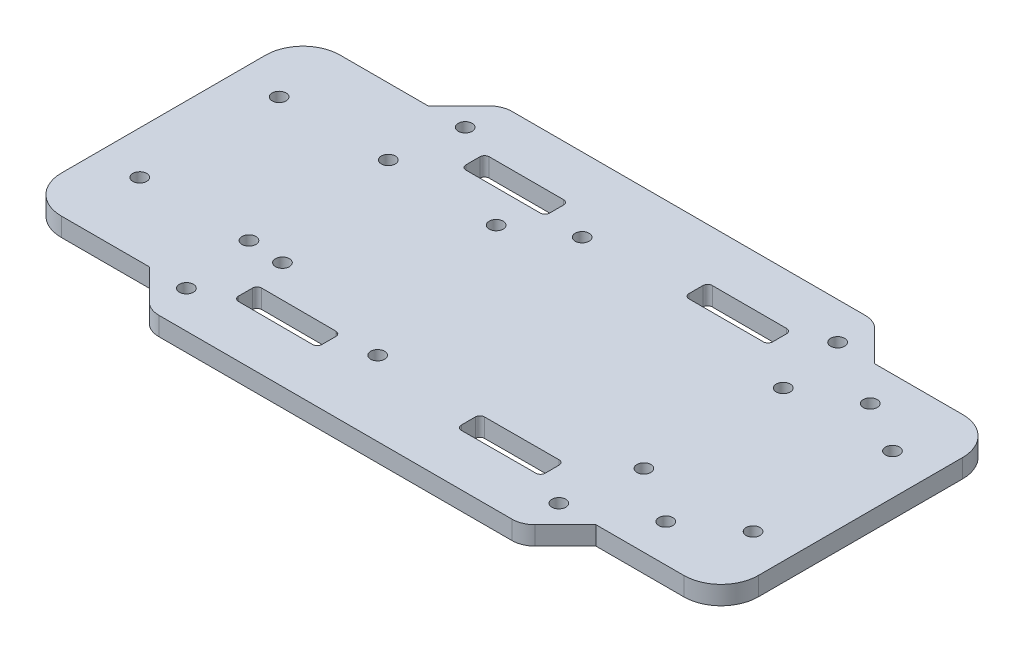
from build123d import *

# Parameters (mm, degrees)
SKETCH1_R           = 1.5
BOSS_EXTRUDE1_DEPTH = 4
SKETCH2_R           = 1.5
CUT_EXTRUDE1_DEPTH  = 4
SKETCH8_R           = 1.5
CUT_EXTRUDE5_DEPTH  = 85.436165497
SKETCH9_R           = 1.5
CUT_EXTRUDE6_DEPTH  = 10
CUT_EXTRUDE7_DEPTH  = 10


with BuildPart() as part:
    # Sketch1 → Boss-Extrude1 (new body)
    with BuildSketch(Plane(origin=(0, 0, 0), x_dir=(1, 0, 0), z_dir=(0, 1, 0))):
        with BuildLine():
            Line((-48.31716421, 29.901561441), (-41.781630304, 36.437095347))
            ThreePointArc((-41.781630304, 36.437095347), (-40.15951356, 37.520959103), (-38.246096398, 37.901561441))
            Line((-38.246096398, 37.901561441), (37.753903602, 37.901561441))
            ThreePointArc((37.753903602, 37.901561441), (39.667320764, 37.520959103), (41.289437508, 36.437095347))
            Line((41.289437508, 36.437095347), (47.824971414, 29.901561441))
            Line((47.824971414, 29.901561441), (66.753903602, 29.901561441))
            ThreePointArc((66.753903602, 29.901561441), (72.410757852, 27.55841569), (74.753903602, 21.901561441))
            Line((74.753903602, 21.901561441), (74.753903602, -22.098438559))
            ThreePointArc((74.753903602, -22.098438559), (72.410757852, -27.755292809), (66.753903602, -30.098438559))
            Line((66.753903602, -30.098438559), (47.824971414, -30.098438559))
            Line((47.824971414, -30.098438559), (41.289437508, -36.633972465))
            ThreePointArc((41.289437508, -36.633972465), (39.667320764, -37.717836222), (37.753903602, -38.098438559))
            Line((37.753903602, -38.098438559), (-38.246096398, -38.098438559))
            ThreePointArc((-38.246096398, -38.098438559), (-40.15951356, -37.717836222), (-41.781630304, -36.633972465))
            Line((-41.781630304, -36.633972465), (-48.31716421, -30.098438559))
            Line((-48.31716421, -30.098438559), (-67.246096398, -30.098438559))
            ThreePointArc((-67.246096398, -30.098438559), (-72.902950647, -27.755292809), (-75.246096398, -22.098438559))
            Line((-75.246096398, -22.098438559), (-75.246096398, 21.901561441))
            ThreePointArc((-75.246096398, 21.901561441), (-72.902950647, 27.55841569), (-67.246096398, 29.901561441))
            Line((-67.246096398, 29.901561441), (-48.31716421, 29.901561441))
        make_face()
        with Locations(Location((-7.246096398, 22, 0), (0, 0, 270))):
            Circle(SKETCH1_R, mode=Mode.SUBTRACT)
        with Locations(Location((54.753903602, 22, 0), (0, 0, 90))):
            Circle(SKETCH1_R, mode=Mode.SUBTRACT)
        with Locations(Location((54.753903602, -22, 0), (0, 0, 270))):
            Circle(SKETCH1_R, mode=Mode.SUBTRACT)
        with Locations(Location((-7.246096398, -22, 0), (0, 0, 90))):
            Circle(SKETCH1_R, mode=Mode.SUBTRACT)
    extrude(amount=-BOSS_EXTRUDE1_DEPTH)

    # Sketch2 → Cut-Extrude1 (cut)
    with BuildSketch(Plane(origin=(0, 0, 0), x_dir=(1, 0, 0), z_dir=(0, 1, 0))):
        with Locations(Location((-42.5, 15.539099556, 0), (0, 0, 270))):
            Circle(SKETCH2_R)
        with Locations(Location((-66, 15.539099556, 0), (0, 0, 270))):
            Circle(SKETCH2_R)
        with Locations(Location((-66, -14.460900444, 0), (0, 0, 270))):
            Circle(SKETCH2_R)
        with Locations(Location((-42.5, -14.460900444, 0), (0, 0, 270))):
            Circle(SKETCH2_R)
        with Locations(Location((66, 15.539099556, 0), (0, 0, 90))):
            Circle(SKETCH2_R)
        with Locations(Location((66, -14.460900444, 0), (0, 0, 90))):
            Circle(SKETCH2_R)
        with Locations(Location((42.5, -14.460900444, 0), (0, 0, 90))):
            Circle(SKETCH2_R)
        with Locations(Location((42.5, 15.539099556, 0), (0, 0, 90))):
            Circle(SKETCH2_R)
    extrude(amount=-CUT_EXTRUDE1_DEPTH, mode=Mode.SUBTRACT)

    # Sketch8 → Cut-Extrude5 (cut, through all)
    with BuildSketch(Plane.XZ.offset(4)):
        with Locations(Location((-40.31716421, -29.901561441, 0), (0, 0, 270))):
            Circle(SKETCH8_R)
        with Locations(Location((39.824971414, -29.901561441, 0), (0, 0, 90))):
            Circle(SKETCH8_R)
        with Locations(Location((39.824971414, 30.098438559, 0), (0, 0, 270))):
            Circle(SKETCH8_R)
        with Locations(Location((-40.31716421, 30.098438559, 0), (0, 0, 90))):
            Circle(SKETCH8_R)
    extrude(amount=-CUT_EXTRUDE5_DEPTH, mode=Mode.SUBTRACT)

    # Sketch9 → Cut-Extrude6 (cut)
    with BuildSketch(Plane(origin=(0, 0, 0), x_dir=(1, 0, 0), z_dir=(0, 1, 0))):
        with Locations(Location((-34.747808705, -15, 0), (0, 0, 270))):
            Circle(SKETCH9_R)
        with Locations(Location((-18.747808705, 15, 0), (0, 0, 270))):
            Circle(SKETCH9_R)
    extrude(amount=-CUT_EXTRUDE6_DEPTH, mode=Mode.SUBTRACT)

    # Sketch10 → Cut-Extrude7 (cut)
    with BuildSketch(Plane(origin=(0, 0, 0), x_dir=(1, 0, 0), z_dir=(0, 1, 0))):
        with BuildLine():
            Line((15.753903602, 22), (31.753903602, 22))
            ThreePointArc((31.753903602, 22), (32.461010383, 22.292893219), (32.753903602, 23))
            Line((32.753903602, 23), (32.753903602, 26))
            ThreePointArc((32.753903602, 26), (32.461010383, 26.707106781), (31.753903602, 27))
            Line((31.753903602, 27), (15.753903602, 27))
            ThreePointArc((15.753903602, 27), (15.046796821, 26.707106781), (14.753903602, 26))
            Line((14.753903602, 26), (14.753903602, 23))
            ThreePointArc((14.753903602, 23), (15.046796821, 22.292893219), (15.753903602, 22))
        make_face()
        with BuildLine():
            Line((-32.256634528, -26.962874327), (-16.256690018, -27.005012975))
            ThreePointArc((-16.256690018, -27.005012975), (-15.548814306, -26.713983054), (-15.25405982, -26.007650108))
            Line((-15.25405982, -26.007650108), (-15.246158824, -23.007660513))
            ThreePointArc((-15.246158824, -23.007660513), (-15.537188744, -22.299784801), (-16.24352169, -22.005030315))
            Line((-16.24352169, -22.005030315), (-32.243466201, -21.962891667))
            ThreePointArc((-32.243466201, -21.962891667), (-32.951341912, -22.253921588), (-33.246096398, -22.960254534))
            Line((-33.246096398, -22.960254534), (-33.253997394, -25.960244129))
            ThreePointArc((-33.253997394, -25.960244129), (-32.962967474, -26.668119841), (-32.256634528, -26.962874327))
        make_face()
        with BuildLine():
            Line((32.753903602, -22.960254534), (32.761804599, -25.960244129))
            ThreePointArc((32.761804599, -25.960244129), (32.470774678, -26.668119841), (31.764441732, -26.962874327))
            Line((31.764441732, -26.962874327), (15.764497222, -27.005012975))
            ThreePointArc((15.764497222, -27.005012975), (15.05662151, -26.713983054), (14.761867024, -26.007650108))
            Line((14.761867024, -26.007650108), (14.753966028, -23.007660513))
            ThreePointArc((14.753966028, -23.007660513), (15.044995948, -22.299784801), (15.751328894, -22.005030315))
            Line((15.751328894, -22.005030315), (31.751273405, -21.962891667))
            ThreePointArc((31.751273405, -21.962891667), (32.459149116, -22.253921588), (32.753903602, -22.960254534))
        make_face()
        with BuildLine():
            Line((-16.246096398, 27), (-32.246096398, 27))
            ThreePointArc((-32.246096398, 27), (-32.953203179, 26.707106781), (-33.246096398, 26))
            Line((-33.246096398, 26), (-33.246096398, 23))
            ThreePointArc((-33.246096398, 23), (-32.953203179, 22.292893219), (-32.246096398, 22))
            Line((-32.246096398, 22), (-16.246096398, 22))
            ThreePointArc((-16.246096398, 22), (-15.538989617, 22.292893219), (-15.246096398, 23))
            Line((-15.246096398, 23), (-15.246096398, 26))
            ThreePointArc((-15.246096398, 26), (-15.538989617, 26.707106781), (-16.246096398, 27))
        make_face()
    extrude(amount=-CUT_EXTRUDE7_DEPTH, mode=Mode.SUBTRACT)


solid = part.part
